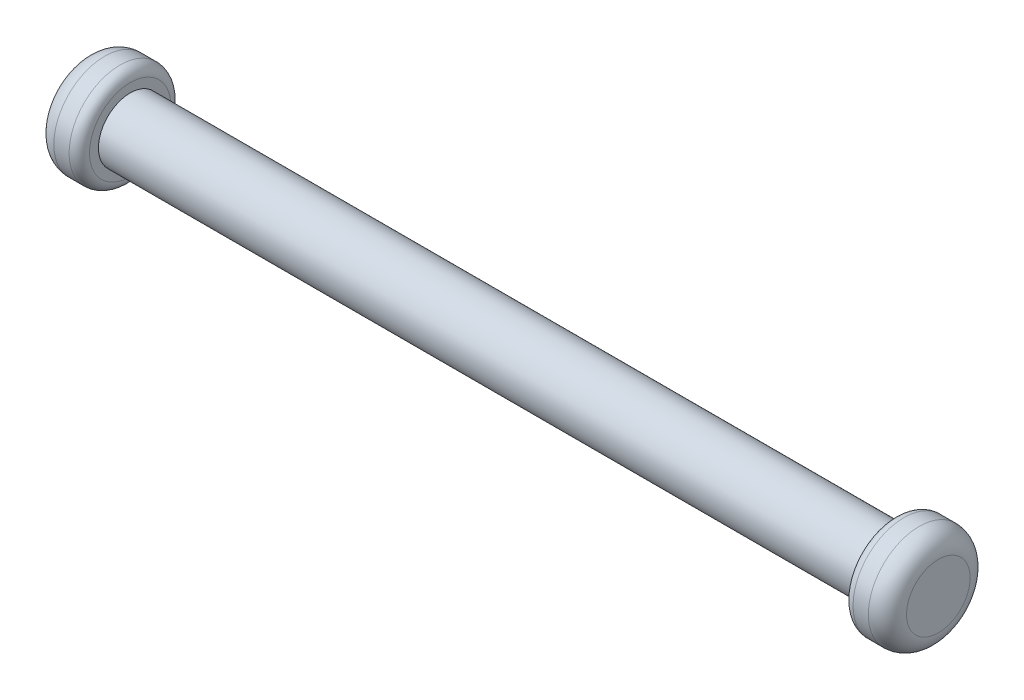
from build123d import *

# Parameters (mm, degrees)
FILLET_1_R = 0.8
FILLET_2_R = 1.5


with BuildPart() as part:
    # Эскиз1 → Повернуть1 (revolve)
    with BuildSketch(Plane.XY, mode=Mode.PRIVATE) as revolve_1_sk:
        Polygon((0, 0), (0, 4), (3.5, 4), (3.5, 2.5), (63.5, 2.5), (63.5, 4), (67, 4), (67, 0), align=None)
    revolve(revolve_1_sk.sketch.rotate(Axis((0, 0, 0), (-1, 0, 0)), 90), axis=Axis((0, 0, 0), (-1, 0, 0)))

    # Скругление1
    fillet_1_edges = [part.edges().sort_by_distance(p)[0] for p in [
        (63.5, 0, 4),
        (3.5, 0, 4),
    ]]
    fillet(fillet_1_edges, radius=FILLET_1_R)

    # Скругление2
    fillet_2_edges = [part.edges().sort_by_distance(p)[0] for p in [
        (67, 0, 4),
        (0, 0, 4),
    ]]
    fillet(fillet_2_edges, radius=FILLET_2_R)


solid = part.part
